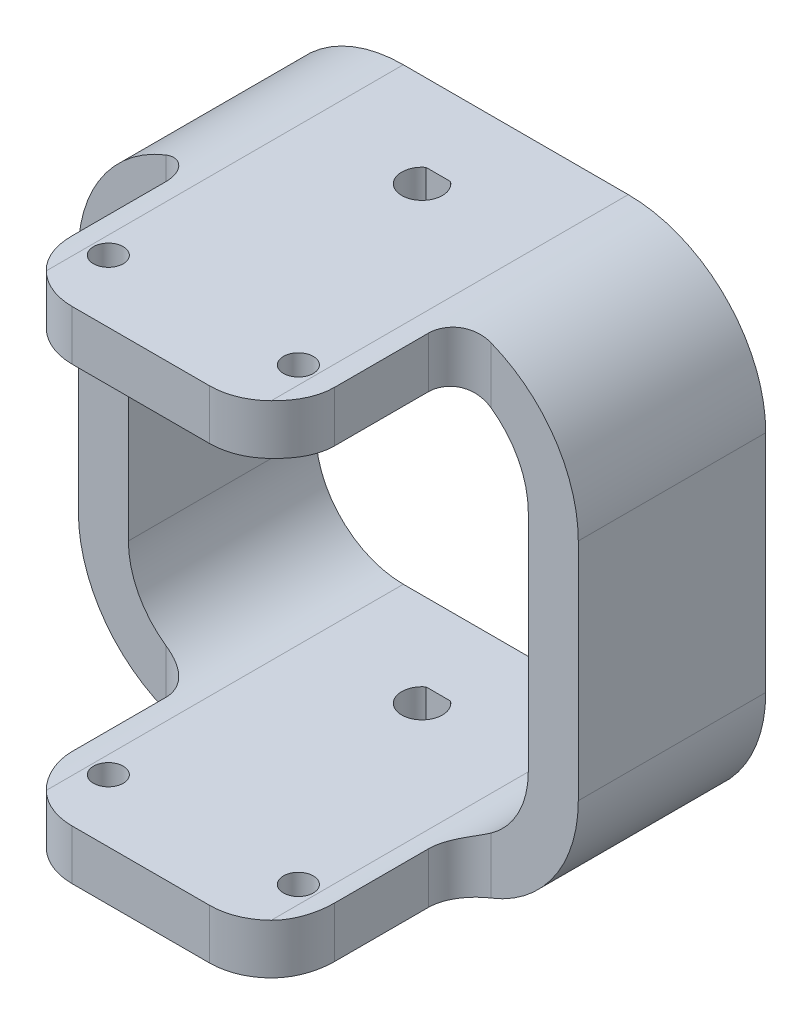
from build123d import *

# Parameters (mm, degrees)
ESQUISSE1_W                             = 80
ESQUISSE1_H                             = 80
ESQUISSE1_W_2                           = 64
ESQUISSE1_H_2                           = 64
BOSS_EXTRU_1_DEPTH                      = 15
ESQUISSE7_W                             = 42
ESQUISSE7_H                             = 8
BOSS_EXTRU_4_DEPTH                      = 30
PER_AGE_POUR_CROUS_AUTO_BLOQUANTS_300_D = 4.7625
CONG_1_R                                = 10
CONG_1_OF_SYM_TRIE2_R                   = 10
CONG_2_R                                = 22
CONG_3_R                                = 14
CONG_4_R                                = 5
ENL_V_MAT_EXTRU_3_DEPTH                 = 124.389626959


with BuildPart() as part:
    # Esquisse1 → Boss.-Extru.1 (new, symmetric)
    with BuildSketch(Plane.XY):
        Rectangle(ESQUISSE1_W, ESQUISSE1_H)
        Rectangle(ESQUISSE1_W_2, ESQUISSE1_H_2, mode=Mode.SUBTRACT)
    extrude(amount=BOSS_EXTRU_1_DEPTH, both=True)

    # Esquisse7 → Boss.-Extru.4 (add)
    with BuildSketch(Plane.XY.offset(15)):
        with Locations((0, 36)):
            Rectangle(ESQUISSE7_W, ESQUISSE7_H)
    boss_extru_4 = extrude(amount=BOSS_EXTRU_4_DEPTH)

    # Perçage pour écrous auto-bloquants 300® #6 (SP)1 (through all)
    with Locations(Plane(origin=(0, 40, 0), x_dir=(0, 0, -1), z_dir=(0, 1, 0))):
        with Locations((-35, -15.205), (-35, 15.205)):
            per_age_pour_crous_auto_bloquants_300 = Hole(PER_AGE_POUR_CROUS_AUTO_BLOQUANTS_300_D / 2)

    # Congé1
    cong_1_edges = [part.edges().sort_by_distance(p)[0] for p in [
        (21, 36, 45),
        (-21, 36, 45),
    ]]
    fillet(cong_1_edges, radius=CONG_1_R)

    # Symétrie2: Boss.-Extru.4, Perçage pour écrous auto-bloquants 300® #6 (SP)1 across plane
    add(boss_extru_4.mirror(Plane.ZX))
    add(per_age_pour_crous_auto_bloquants_300.mirror(Plane.ZX), mode=Mode.SUBTRACT)

    # Congé1 of Symétrie2
    cong_1_of_sym_trie2_edges = [part.edges().sort_by_distance(p)[0] for p in [
        (21, -36, 45),
        (-21, -36, 45),
    ]]
    fillet(cong_1_of_sym_trie2_edges, radius=CONG_1_OF_SYM_TRIE2_R)

    # Congé2
    cong_2_edges = [part.edges().sort_by_distance(p)[0] for p in [
        (40, -40, 0),
        (-40, -40, 0),
        (-40, 40, 0),
        (40, 40, 0),
    ]]
    fillet(cong_2_edges, radius=CONG_2_R)

    # Congé3
    cong_3_edges = [part.edges().sort_by_distance(p)[0] for p in [
        (-32, 32, 0),
        (-32, -32, 0),
        (32, -32, 0),
        (32, 32, 0),
    ]]
    fillet(cong_3_edges, radius=CONG_3_R)

    # Congé4
    cong_4_edges = [part.edges().sort_by_distance(p)[0] for p in [
        (-21, -35.734644524, 15),
        (-21, 35.734644524, 15),
        (21, 35.734644524, 15),
        (21, -35.734644524, 15),
    ]]
    fillet(cong_4_edges, radius=CONG_4_R)

    # Esquisse11 → Enlèv. mat.-Extru.3 (cut, through all)
    with BuildSketch(Plane(origin=(0, -40, -40), x_dir=(1, 0, 0), z_dir=(0, 1, 0))):
        with BuildLine():
            Line((1.964942747, -37.405), (-1.964942747, -37.405))
            ThreePointArc((-1.964942747, -37.405), (0, -43.255), (1.964942747, -37.405))
        make_face()
    extrude(amount=ENL_V_MAT_EXTRU_3_DEPTH, mode=Mode.SUBTRACT)


solid = part.part
